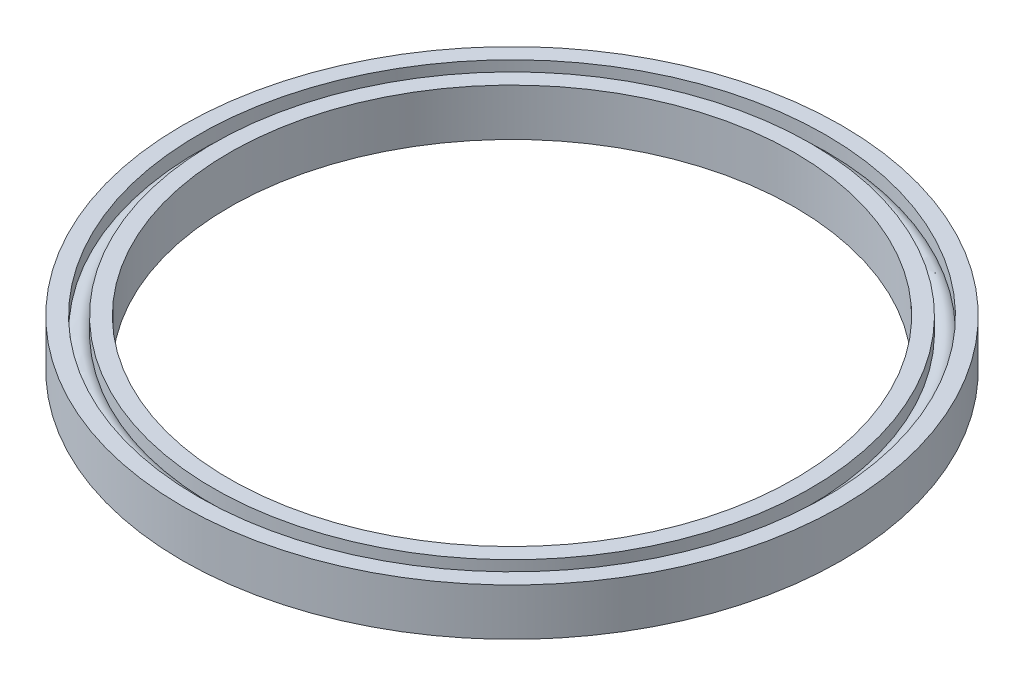
from build123d import *

# Parameters (mm, degrees)
SKETCH_1_R = 1.5875


with BuildPart() as part:
    # 草图1 → 旋转1 (revolve)
    with BuildSketch(Plane.XY, mode=Mode.PRIVATE) as revolve_1_sk:
        with BuildLine():
            Line((42.275, 6.35), (42.275, 4.407946167))
            ThreePointArc((42.275, 4.407946167), (42.708118322, 3.857882219), (42.8625, 3.175))
            ThreePointArc((42.8625, 3.175), (42.708118322, 2.492117781), (42.275, 1.942053833))
            Line((42.275, 1.942053833), (42.275, 0))
            Line((42.275, 0), (44.45, 0))
            Line((44.45, 0), (44.45, 6.1))
            Line((44.45, 6.1), (44.45, 6.35))
            Line((44.45, 6.35), (42.275, 6.35))
        make_face()
        with BuildLine():
            Line((40.275, 6.35), (38.1, 6.35))
            Line((38.1, 6.35), (38.1, 6.1))
            Line((38.1, 6.1), (38.1, 0))
            Line((38.1, 0), (40.275, 0))
            Line((40.275, 0), (40.275, 1.942053833))
            ThreePointArc((40.275, 1.942053833), (39.6875, 3.175), (40.275, 4.407946167))
            Line((40.275, 4.407946167), (40.275, 6.35))
        make_face()
        with Locations((41.275, 3.175)):
            Circle(SKETCH_1_R)
    revolve(revolve_1_sk.sketch.rotate(Axis((0, 13.35, 0), (0, 1, 0)), 90), axis=Axis((0, 13.35, 0), (0, 1, 0)))


solid = part.part
